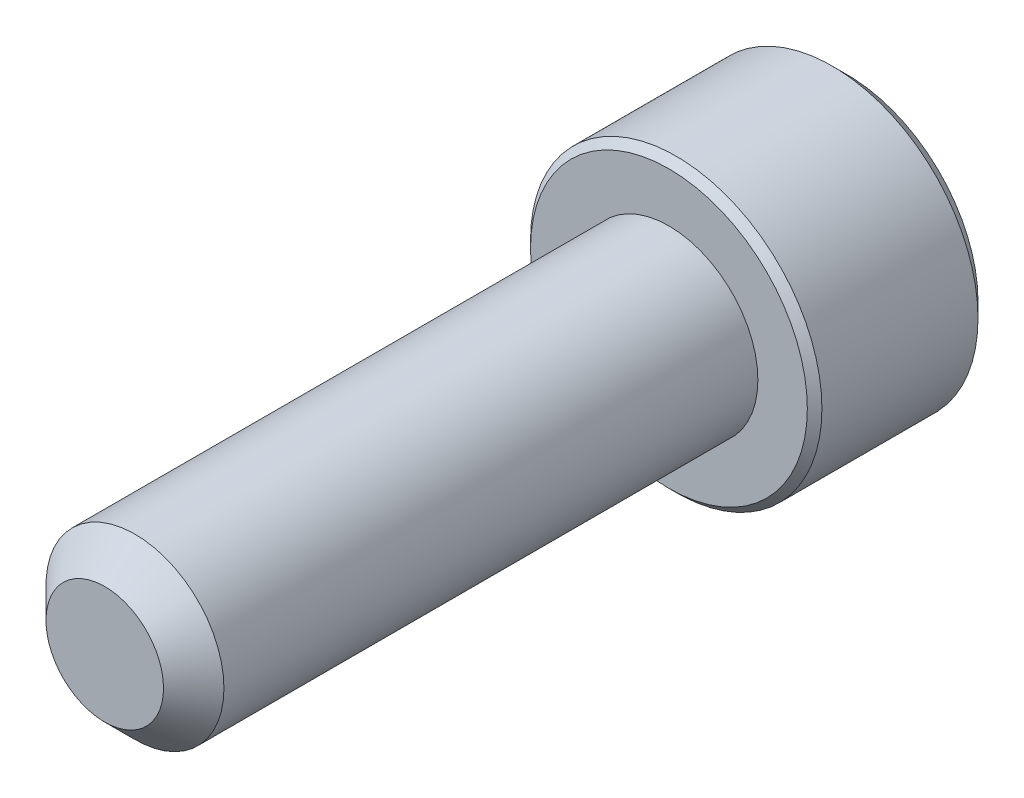
from build123d import *

# Parameters (mm, degrees)
SKETCH1_R          = 1.7526
EXTRUDE1_DEPTH     = 11.1125
CHAMFER3_SIZE      = 0.5953125
SKETCH6_R          = 2.8702
EXTRUDE2_DEPTH     = 3.5052
CUT_EXTRUDE1_DEPTH = 2.08359375
CHAMFER1_SIZE      = 0.28702
CHAMFER2_SIZE      = 0.14351


with BuildPart() as part:
    # Sketch1 → Extrude1 (new body)
    with BuildSketch(Plane.XY):
        Circle(SKETCH1_R)
    extrude(amount=-EXTRUDE1_DEPTH)

    # Chamfer3
    chamfer3_edges = [part.edges().sort_by_distance(p)[0] for p in [
        (-1.7526, 0, 0),
    ]]
    chamfer(chamfer3_edges, length=CHAMFER3_SIZE)

    # Sketch6 → Extrude2 (add)
    with BuildSketch(Plane(origin=(0, 0, -11.1125), x_dir=(-1, 0, 0), z_dir=(0, 0, -1))):
        Circle(SKETCH6_R)
    extrude(amount=EXTRUDE2_DEPTH)

    # Sketch7 → Cut-Extrude1 (cut)
    with BuildSketch(Plane(origin=(0, 0, -14.6177), x_dir=(-1, 0, 0), z_dir=(0, 0, -1))):
        Polygon((0, 1.603951217), (-1.3890625, 0.801975608), (-1.3890625, -0.801975608), (0, -1.603951217), (1.3890625, -0.801975608), (1.3890625, 0.801975608), align=None)
    extrude(amount=-CUT_EXTRUDE1_DEPTH, mode=Mode.SUBTRACT)

    # Cut-Extrude2 cone 1 section (through the dimple's axis) → Cut-Extrude2 (revolve, cut)
    with BuildSketch(Plane(origin=(0, 0, -14.6177), x_dir=(0, 1, 0), z_dir=(1, 0, 0))):
        Polygon((0, 0), (1.603951217, 0), (0, 1.603951217), align=None)
    revolve(axis=Axis((0, 0, -14.6177), (0, 0, 1)), mode=Mode.SUBTRACT)

    # Chamfer1
    chamfer1_edges = [part.edges().sort_by_distance(p)[0] for p in [
        (2.8702, 0, -14.6177),
    ]]
    chamfer(chamfer1_edges, length=CHAMFER1_SIZE)

    # Chamfer2
    chamfer2_edges = [part.edges().sort_by_distance(p)[0] for p in [
        (2.8702, 0, -11.1125),
    ]]
    chamfer(chamfer2_edges, length=CHAMFER2_SIZE)


solid = part.part
